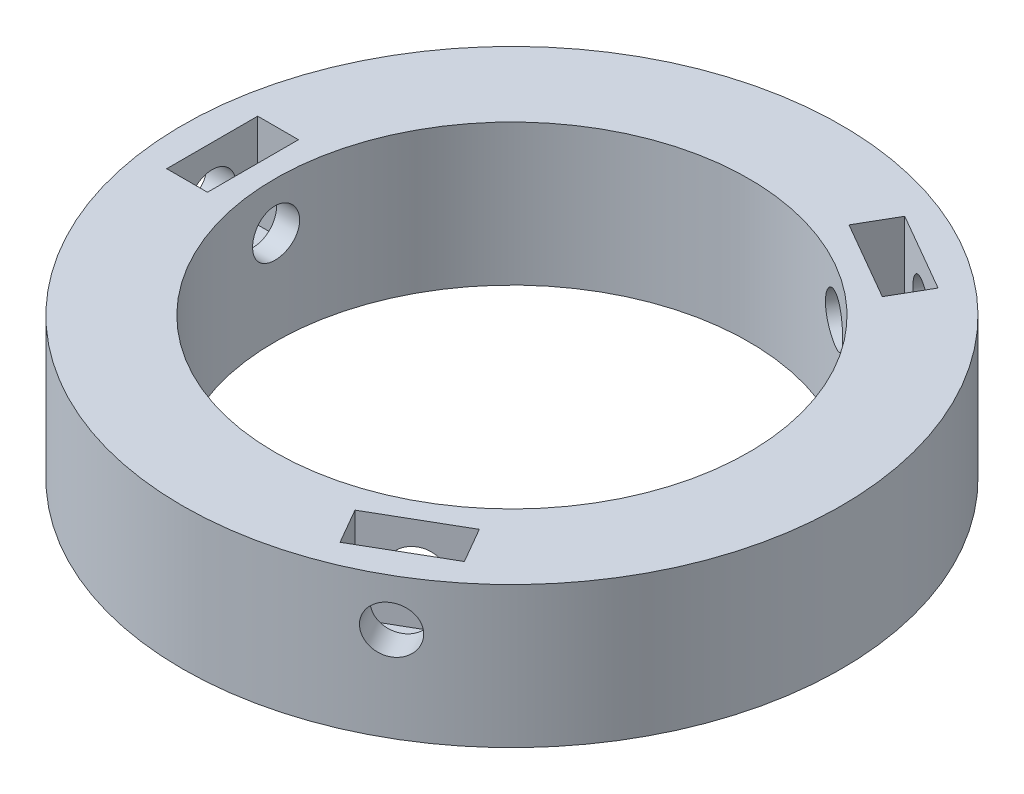
from build123d import *

# Parameters (mm, degrees)
SKETCH1_R           = 21
SKETCH1_R_2         = 15.1
BOSS_EXTRUDE1_DEPTH = 9
SKETCH2_W           = 2.6
SKETCH2_H           = 5.8
CUT_EXTRUDE1_DEPTH  = 6
SKETCH3_R           = 1.5
CUT_EXTRUDE2_DEPTH  = 6
CIRPATTERN1_COUNT   = 3


with BuildPart() as part:
    # Sketch1 → Boss-Extrude1 (new body)
    with BuildSketch(Plane(origin=(0, 0, 0), x_dir=(1, 0, 0), z_dir=(0, 1, 0))):
        Circle(SKETCH1_R)
        Circle(SKETCH1_R_2, mode=Mode.SUBTRACT)
    extrude(amount=BOSS_EXTRUDE1_DEPTH)

    # Sketch2 → Cut-Extrude1 (cut)
    with BuildSketch(Plane(origin=(0, 9, 0), x_dir=(1, 0, 0), z_dir=(0, 1, 0))):
        with Locations((-17.8, 0)):
            Rectangle(SKETCH2_W, SKETCH2_H)
    cut_extrude1 = extrude(amount=-CUT_EXTRUDE1_DEPTH, mode=Mode.SUBTRACT)

    # Sketch3 → Cut-Extrude2 (cut, symmetric)
    with BuildSketch(Plane.ZY.offset(16.5)):
        with Locations((0, 6)):
            Circle(SKETCH3_R)
    cut_extrude2 = extrude(amount=CUT_EXTRUDE2_DEPTH, both=True, mode=Mode.SUBTRACT)

    # CirPattern1: Cut-Extrude1, Cut-Extrude2 ×3 about axis
    cirpattern1_axis = Axis((0, 9.45, 0), (0, -1, 0))
    add([cut_extrude1.rotate(cirpattern1_axis, i * 360 / CIRPATTERN1_COUNT) for i in range(1, CIRPATTERN1_COUNT)], mode=Mode.SUBTRACT)
    add([cut_extrude2.rotate(cirpattern1_axis, i * 360 / CIRPATTERN1_COUNT) for i in range(1, CIRPATTERN1_COUNT)], mode=Mode.SUBTRACT)


solid = part.part
